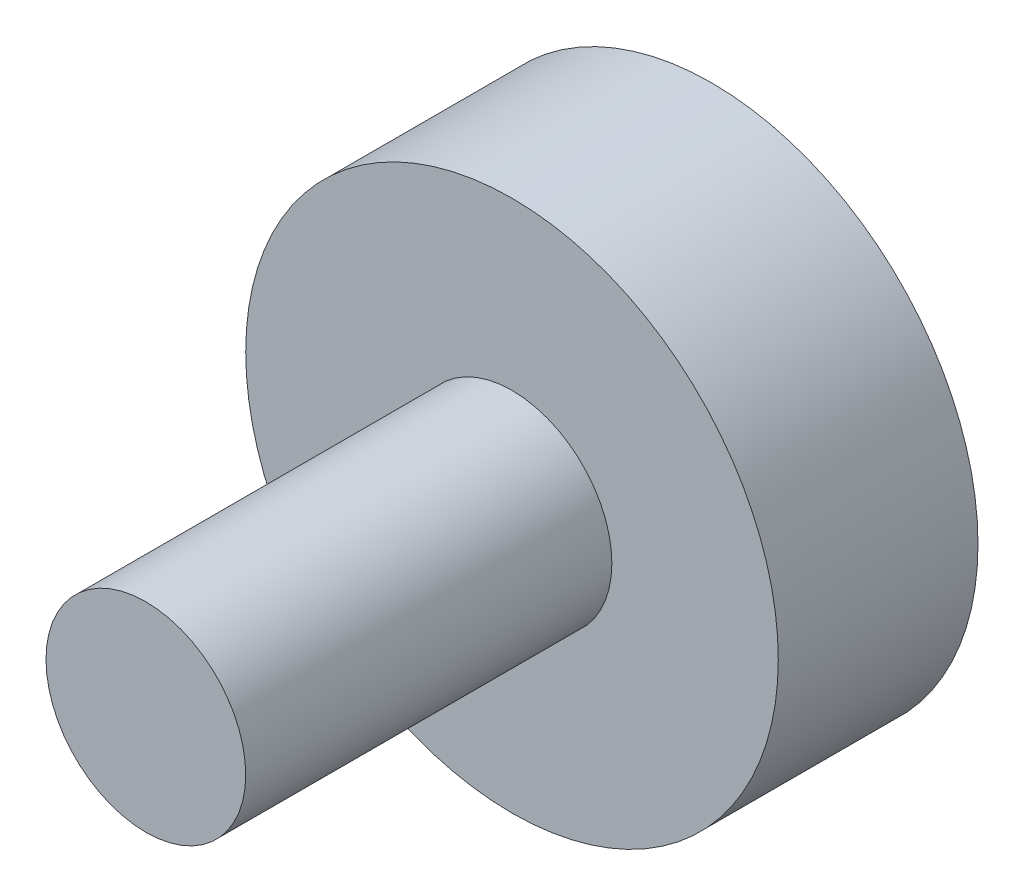
from build123d import *

# Parameters (mm, degrees)
SKETCH1_R           = 101.6
BOSS_EXTRUDE1_DEPTH = 76.2
SKETCH2_R           = 38.1
BOSS_EXTRUDE2_DEPTH = 139.7


with BuildPart() as part:
    # Sketch1 → Boss-Extrude1 (new body)
    with BuildSketch(Plane.XY):
        with Locations(Location((0, 0, 0), (0, 0, 180))):
            Circle(SKETCH1_R)
    extrude(amount=BOSS_EXTRUDE1_DEPTH)

    # Sketch2 → Boss-Extrude2 (add)
    with BuildSketch(Plane.XY.offset(76.2)):
        Circle(SKETCH2_R)
    extrude(amount=BOSS_EXTRUDE2_DEPTH)


solid = part.part
